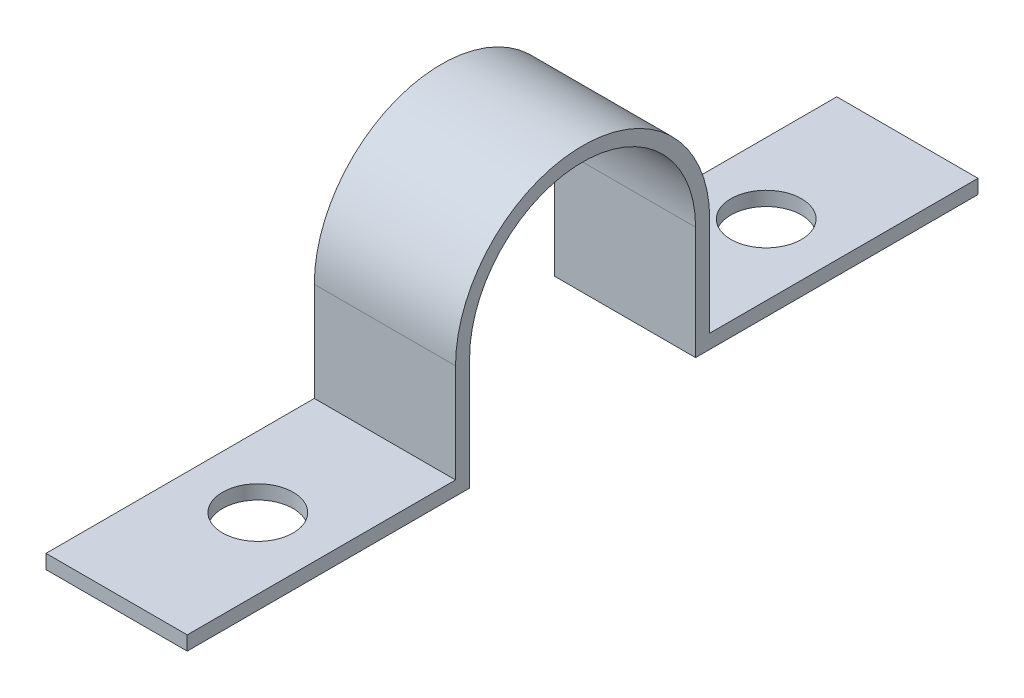
from build123d import *

# Parameters (mm, degrees)
ESTRUSIONE_ESTRUSIONE1_DEPTH = 10
FORI_FILETTATI_5_0MM1_D      = 5
FORI_FILETTATI_5_0MM1_DEPTH  = 10
FORI_FILETTATI_5_0MM1_TIP    = 1.502151548
FORI_FILETTATI_5_0MM2_D      = 5
FORI_FILETTATI_5_0MM2_DEPTH  = 10
FORI_FILETTATI_5_0MM2_TIP    = 1.502151548


with BuildPart() as part:
    # Schizzo2 → Estrusione-Estrusione1 (new body)
    with BuildSketch(Plane(origin=(0, 0, 0), x_dir=(0, 0, -1), z_dir=(1, 0, 0))):
        with BuildLine():
            Line((-28, -7), (-9, -7))
            Line((-9, -7), (-9, 0))
            ThreePointArc((-9, 0), (0, 9), (9, 0))
            Line((9, 0), (9, -7))
            Line((9, -7), (28, -7))
            Line((28, -7), (28, -8))
            Line((28, -8), (8, -8))
            Line((8, -8), (8, 0))
            ThreePointArc((8, 0), (0, 8), (-8, 0))
            Line((-8, 0), (-8, -8))
            Line((-8, -8), (-28, -8))
            Line((-28, -8), (-28, -7))
        make_face()
    extrude(amount=ESTRUSIONE_ESTRUSIONE1_DEPTH)

    # Fori filettati Ø5.0mm1
    with Locations(Plane(origin=(5, -7, -18), x_dir=(0, 0, 1), z_dir=(0, 1, 0))):
        with Locations((0, 0)):
            Hole(FORI_FILETTATI_5_0MM1_D / 2, depth=FORI_FILETTATI_5_0MM1_DEPTH)
            with Locations((0, 0, -(FORI_FILETTATI_5_0MM1_DEPTH + FORI_FILETTATI_5_0MM1_TIP / 2))):  # 118° drill point
                Cone(0, FORI_FILETTATI_5_0MM1_D / 2, FORI_FILETTATI_5_0MM1_TIP, mode=Mode.SUBTRACT)

    # Fori filettati Ø5.0mm2
    with Locations(Plane(origin=(5, -7, 18), x_dir=(0, 0, 1), z_dir=(0, 1, 0))):
        with Locations((0, 0)):
            Hole(FORI_FILETTATI_5_0MM2_D / 2, depth=FORI_FILETTATI_5_0MM2_DEPTH)
            with Locations((0, 0, -(FORI_FILETTATI_5_0MM2_DEPTH + FORI_FILETTATI_5_0MM2_TIP / 2))):  # 118° drill point
                Cone(0, FORI_FILETTATI_5_0MM2_D / 2, FORI_FILETTATI_5_0MM2_TIP, mode=Mode.SUBTRACT)


solid = part.part
